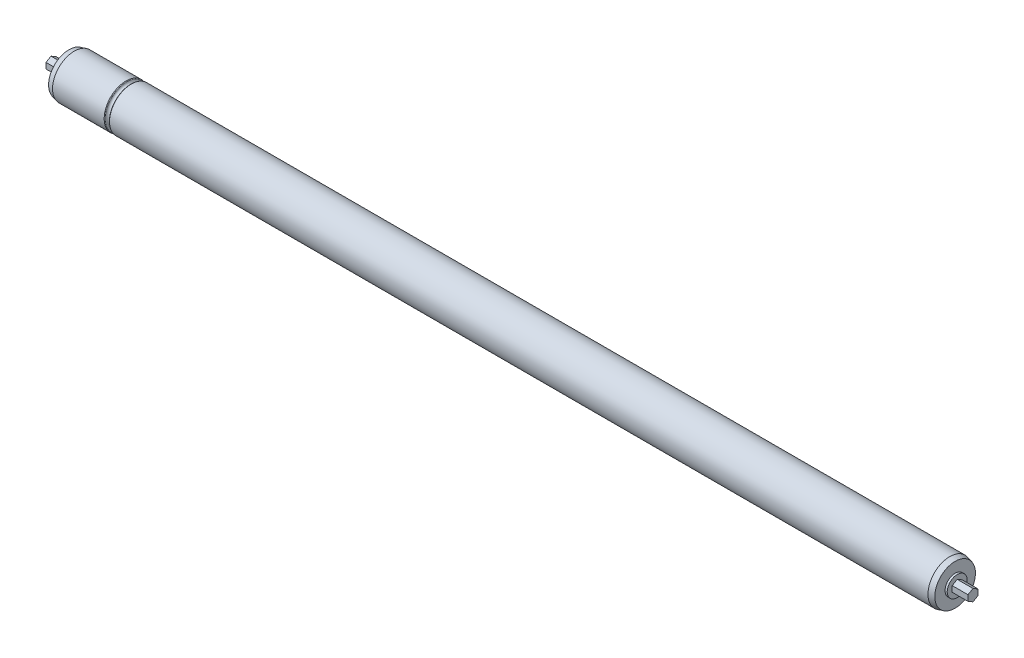
from build123d import *

# Parameters (mm, degrees)
BOSS_EXTRUDE1_DEPTH      = 490.140625
BOSS_EXTRUDE1_DEPTH_BACK = 490.140625
SKETCH3_R                = 24.13
SKETCH6_OUTSIDE_W        = 776.952
SKETCH6_OUTSIDE_H        = 776.952
SKETCH6_OUTSIDE_R        = 22.540972993
CUT_EXTRUDE2_DEPTH       = 986.634670258
CUT_EXTRUDE2_DRAFT       = -15
SKETCH7_OUTSIDE_W        = 776.952
SKETCH7_OUTSIDE_H        = 776.952
SKETCH7_OUTSIDE_R        = 22.540972993
CUT_EXTRUDE3_DEPTH       = 986.634670258
CUT_EXTRUDE3_DRAFT       = -15
BOSS_EXTRUDE2_DEPTH      = 511.175
BOSS_EXTRUDE2_DEPTH_BACK = 511.175


with BuildPart() as part:
    # Sketch2 → Revolve1 (revolve)
    with BuildSketch(Plane.XY, mode=Mode.PRIVATE) as revolve1_sk:
        Polygon((-493.7125, 0), (-493.7125, 11.1125), (-491.33125, 11.1125), (-491.33125, 22.540972993), (-490.140625, 22.86), (-490.140625, 0), align=None)
    revolve(revolve1_sk.sketch.rotate(Axis((-493.7125, 0, 0), (1, 0, 0)), 180), axis=Axis((-493.7125, 0, 0), (1, 0, 0)))


with BuildPart() as body_2:
    # Mirror2: mirrored copy
    add(part.part.mirror(Plane(origin=(0, 0, 0), x_dir=(0, 0, 1), z_dir=(1, 0, 0))))


with BuildPart() as body_3:
    # Sketch3 → Boss-Extrude1 (new, two sides: drawn at the far end of the back side and taken through both)
    with BuildSketch(Plane(origin=(0, 0, 0), x_dir=(0, 0, -1), z_dir=(1, 0, 0)).offset(-BOSS_EXTRUDE1_DEPTH_BACK)):
        Circle(SKETCH3_R)
    extrude(amount=BOSS_EXTRUDE1_DEPTH + BOSS_EXTRUDE1_DEPTH_BACK)


with BuildPart() as cut_extrude2_tool:
    # Sketch6 outside → Cut-Extrude2 (with draft: the straight prism first)
    with BuildSketch(Plane.ZY.offset(491.33125)):
        Rectangle(SKETCH6_OUTSIDE_W, SKETCH6_OUTSIDE_H)
        Circle(SKETCH6_OUTSIDE_R, mode=Mode.SUBTRACT)
    extrude(amount=-CUT_EXTRUDE2_DEPTH)
    # Cut-Extrude2: the draft: its side faces are tilted about the plane it starts from
    cut_extrude2_sides = [cut_extrude2_tool.faces().sort_by_distance(p)[0] for p in [
        (1.986085129, -388.476, 0),
        (1.986085129, 0, 388.476),
        (1.986085129, 388.476, 0),
        (1.986085129, 0, -388.476),
        (1.986085129, 0, -22.540972993),
    ]]
    draft(cut_extrude2_sides, Plane.ZY.offset(491.33125), CUT_EXTRUDE2_DRAFT)


with BuildPart() as body_3_1:
    add(body_3.part)

    # Cut-Extrude2: cut by cut_extrude2_tool
    add(cut_extrude2_tool.part, mode=Mode.SUBTRACT)


with BuildPart() as cut_extrude3_tool:
    # Sketch7 outside → Cut-Extrude3 (with draft: the straight prism first)
    with BuildSketch(Plane(origin=(491.33125, 0, 0), x_dir=(0, 0, -1), z_dir=(1, 0, 0))):
        Rectangle(SKETCH7_OUTSIDE_W, SKETCH7_OUTSIDE_H)
        Circle(SKETCH7_OUTSIDE_R, mode=Mode.SUBTRACT)
    extrude(amount=-CUT_EXTRUDE3_DEPTH)
    # Cut-Extrude3: the draft: its side faces are tilted about the plane it starts from
    cut_extrude3_sides = [cut_extrude3_tool.faces().sort_by_distance(p)[0] for p in [
        (-1.986085129, -388.476, 0),
        (-1.986085129, 0, -388.476),
        (-1.986085129, 388.476, 0),
        (-1.986085129, 0, 388.476),
        (-1.986085129, 0, 22.540972993),
    ]]
    draft(cut_extrude3_sides, Plane(origin=(491.33125, 0, 0), x_dir=(0, 0, -1), z_dir=(1, 0, 0)), CUT_EXTRUDE3_DRAFT)


with BuildPart() as body_3_2:
    add(body_3_1.part)

    # Cut-Extrude3: cut by cut_extrude3_tool
    add(cut_extrude3_tool.part, mode=Mode.SUBTRACT)


with BuildPart() as part_1:
    add(part.part)

    add(body_2.part)  # Boss-Extrude2 merges body 2

    add(body_3_2.part)  # Boss-Extrude2 merges body 3
    # Sketch4 → Boss-Extrude2 (add, two sides: drawn at the far end of the back side and taken through both)
    with BuildSketch(Plane(origin=(0, 0, 0), x_dir=(0, 0, -1), z_dir=(1, 0, 0)).offset(-BOSS_EXTRUDE2_DEPTH_BACK)):
        Polygon((0, 6.415804866), (-5.55625, 3.207902433), (-5.55625, -3.207902433), (0, -6.415804866), (5.55625, -3.207902433), (5.55625, 3.207902433), align=None)
    extrude(amount=BOSS_EXTRUDE2_DEPTH + BOSS_EXTRUDE2_DEPTH_BACK)

    # Sketch5 → Cut-Revolve1 (revolve, cut)
    with BuildSketch(Plane.XY, mode=Mode.PRIVATE) as cut_revolve1_sk:
        with BuildLine():
            Line((-428.30115, 24.1554), (-428.30115, 24.7904))
            Line((-428.30115, 24.7904), (-421.96385, 24.7904))
            Line((-421.96385, 24.7904), (-421.96385, 24.1554))
            ThreePointArc((-421.96385, 24.1554), (-422.52062588, 23.92477588), (-422.75125, 23.368))
            ThreePointArc((-422.75125, 23.368), (-425.1325, 20.98675), (-427.51375, 23.368))
            ThreePointArc((-427.51375, 23.368), (-427.74437412, 23.92477588), (-428.30115, 24.1554))
        make_face()
    revolve(cut_revolve1_sk.sketch.rotate(Axis((-511.175, 0, 0), (1, 0, 0)), 180), axis=Axis((-511.175, 0, 0), (1, 0, 0)), mode=Mode.SUBTRACT)


solid = part_1.part
